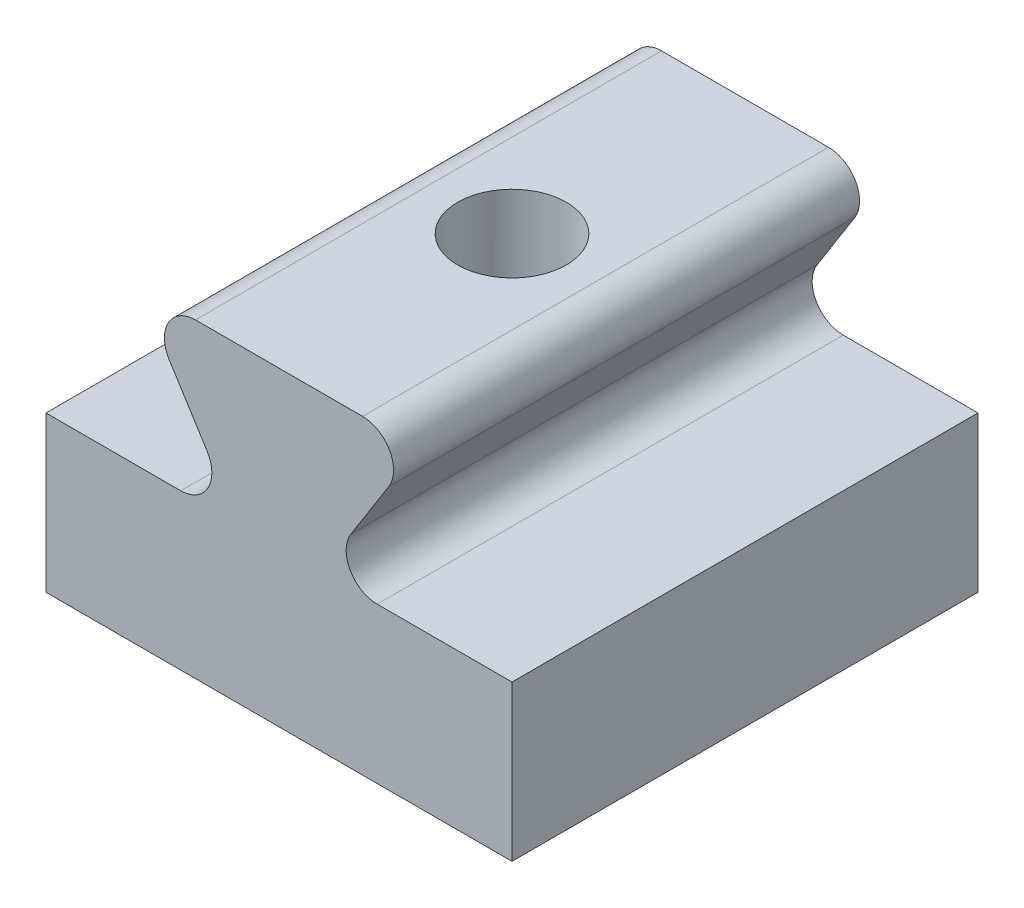
from build123d import *

# Parameters (mm, degrees)
ESBO_O1_W                = 15
ESBO_O1_H                = 5
RESSALTO_EXTRUS_O1_DEPTH = 15
FILETE1_R                = 1
ESBO_O2_R                = 1.75
CORTE_EXTRUS_O1_DEPTH    = 15


with BuildPart() as part:
    # Esboço1 → Ressalto-extrusão1 (new body)
    with BuildSketch(Plane.XY):
        with Locations((0, -2.5)):
            Rectangle(ESBO_O1_W, ESBO_O1_H)
        Polygon((-4.5, 5), (-1.35, 0), (1.35, 0), (4.5, 5), align=None)
    extrude(amount=RESSALTO_EXTRUS_O1_DEPTH)

    # Filete1
    filete1_edges = [part.edges().sort_by_distance(p)[0] for p in [
        (-1.35, 0, 7.5),
        (-4.5, 5, 7.5),
        (4.5, 5, 7.5),
        (1.35, 0, 7.5),
    ]]
    fillet(filete1_edges, radius=FILETE1_R)

    # Esboço2 → Corte-extrusão1 (cut)
    with BuildSketch(Plane(origin=(0, 5, 0), x_dir=(1, 0, 0), z_dir=(0, 1, 0))):
        with Locations(Location((0, -7.5, 0), (0, 0, 270))):
            Circle(ESBO_O2_R)
    extrude(amount=-CORTE_EXTRUS_O1_DEPTH, mode=Mode.SUBTRACT)


solid = part.part
